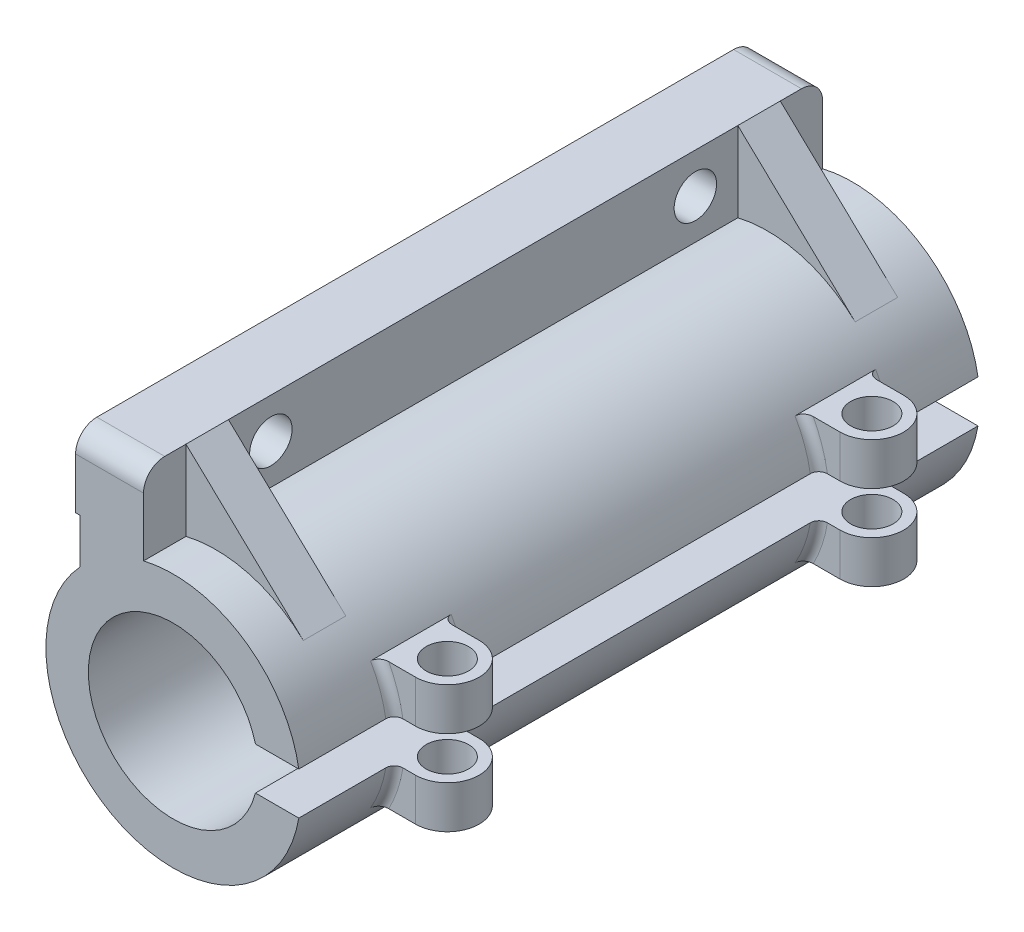
from build123d import *

# Parameters (mm, degrees)
BOSS_EXTRUDE1_DEPTH = 40
BOSS_EXTRUDE2_START = 30
BOSS_EXTRUDE2_DEPTH = 5
BOSS_EXTRUDE3_START = -35
BOSS_EXTRUDE3_DEPTH = 5
SKETCH2_R           = 2.5
CUT_EXTRUDE1_DEPTH  = 15
BOSS_EXTRUDE4_START = 2.5
SKETCH4_R           = 2.5
BOSS_EXTRUDE4_DEPTH = 5
BOSS_EXTRUDE5_START = -7.5
SKETCH4_2_R         = 2.5
BOSS_EXTRUDE5_DEPTH = 5
FILLET1_R           = 1
FILLET2_R           = 2.5


with BuildPart() as part:
    # Sketch1 → Boss-Extrude1 (new, symmetric)
    with BuildSketch(Plane.XY):
        with BuildLine():
            Line((-3.5, 14.585952146), (-3.5, 24))
            Line((-3.5, 24), (-11, 24))
            Line((-11, 24), (-11.5, 24))
            Line((-11.5, 24), (-11.5, 15.5))
            Line((-11.5, 15.5), (-11, 15.5))
            Line((-11, 15.5), (-11, 10.198039027))
            ThreePointArc((-11, 10.198039027), (-6.625817064, -13.457286065), (14.790199458, -2.5))
            Line((14.790199458, -2.5), (9.682458366, -2.5))
            ThreePointArc((9.682458366, -2.5), (-10, 0), (9.682458366, 2.5))
            Line((9.682458366, 2.5), (14.790199458, 2.5))
            ThreePointArc((14.790199458, 2.5), (13.238381204, 7.053032191), (10.325172425, 10.880754312))
            ThreePointArc((10.325172425, 10.880754312), (3.883022973, 14.488689816), (-3.5, 14.585952146))
        make_face()
    extrude(amount=BOSS_EXTRUDE1_DEPTH, both=True)

    # Sketch1<3> → Boss-Extrude2 (add)
    with BuildSketch(Plane.XY.offset(BOSS_EXTRUDE2_START)):
        with BuildLine():
            Line((10.325172425, 10.880754312), (-3.5, 24))
            Line((-3.5, 24), (-3.5, 14.585952146))
            ThreePointArc((-3.5, 14.585952146), (3.883022973, 14.488689816), (10.325172425, 10.880754312))
        make_face()
    extrude(amount=BOSS_EXTRUDE2_DEPTH)

    # Sketch1<4> → Boss-Extrude3 (add)
    with BuildSketch(Plane.XY.offset(BOSS_EXTRUDE3_START)):
        with BuildLine():
            Line((10.325172425, 10.880754312), (-3.5, 24))
            Line((-3.5, 24), (-3.5, 14.585952146))
            ThreePointArc((-3.5, 14.585952146), (3.883022973, 14.488689816), (10.325172425, 10.880754312))
        make_face()
    extrude(amount=BOSS_EXTRUDE3_DEPTH)

    # Sketch2 → Cut-Extrude1 (cut)
    with BuildSketch(Plane(origin=(0, 0, 0), x_dir=(0, 0, -1), z_dir=(1, 0, 0))):
        with Locations((-25, 19.292976073)):
            Circle(SKETCH2_R)
        with Locations((25, 19.292976073)):
            Circle(SKETCH2_R)
    extrude(amount=-CUT_EXTRUDE1_DEPTH, mode=Mode.SUBTRACT)

    # Sketch4 → Boss-Extrude4 (add)
    # profile 1 of 2: a face of its own
    with BuildSketch(Plane(origin=(0, 0, 0), x_dir=(1, 0, 0), z_dir=(0, 1, 0)).offset(BOSS_EXTRUDE4_START)):
        with BuildLine():
            Line((17.290199458, 21.25), (12.290199458, 21.25))
            Line((12.290199458, 21.25), (12.290199458, 28.75))
            Line((12.290199458, 28.75), (17.290199458, 28.75))
            ThreePointArc((17.290199458, 28.75), (21.040199458, 25), (17.290199458, 21.25))
        make_face()
        with Locations((17.290199458, 25)):
            Circle(SKETCH4_R, mode=Mode.SUBTRACT)
    # profile 2 of 2: a face of its own
    with BuildSketch(Plane(origin=(0, 0, 0), x_dir=(1, 0, 0), z_dir=(0, 1, 0)).offset(BOSS_EXTRUDE4_START)):
        with BuildLine():
            Line((12.290199458, -28.75), (17.290199458, -28.75))
            ThreePointArc((17.290199458, -28.75), (21.040199458, -25), (17.290199458, -21.25))
            Line((17.290199458, -21.25), (12.290199458, -21.25))
            Line((12.290199458, -21.25), (12.290199458, -28.75))
        make_face()
        with Locations((17.290199458, -25)):
            Circle(SKETCH4_R, mode=Mode.SUBTRACT)
    extrude(amount=BOSS_EXTRUDE4_DEPTH)

    # Sketch4<2> → Boss-Extrude5 (add)
    # profile 1 of 2: a face of its own
    with BuildSketch(Plane(origin=(0, 0, 0), x_dir=(1, 0, 0), z_dir=(0, 1, 0)).offset(BOSS_EXTRUDE5_START)):
        with BuildLine():
            Line((17.290199458, 21.25), (12.290199458, 21.25))
            Line((12.290199458, 21.25), (12.290199458, 28.75))
            Line((12.290199458, 28.75), (17.290199458, 28.75))
            ThreePointArc((17.290199458, 28.75), (21.040199458, 25), (17.290199458, 21.25))
        make_face()
        with Locations((17.290199458, 25)):
            Circle(SKETCH4_2_R, mode=Mode.SUBTRACT)
    # profile 2 of 2: a face of its own
    with BuildSketch(Plane(origin=(0, 0, 0), x_dir=(1, 0, 0), z_dir=(0, 1, 0)).offset(BOSS_EXTRUDE5_START)):
        with BuildLine():
            Line((12.290199458, -28.75), (17.290199458, -28.75))
            ThreePointArc((17.290199458, -28.75), (21.040199458, -25), (17.290199458, -21.25))
            Line((17.290199458, -21.25), (12.290199458, -21.25))
            Line((12.290199458, -21.25), (12.290199458, -28.75))
        make_face()
        with Locations((17.290199458, -25)):
            Circle(SKETCH4_2_R, mode=Mode.SUBTRACT)
    extrude(amount=BOSS_EXTRUDE5_DEPTH)

    # Fillet1
    fillet1_edges = [part.edges().sort_by_distance(p)[0] for p in [
        (14.113474534, 5.080338234, 21.25),
        (14.113474534, 5.080338234, 28.75),
        (14.113474534, -5.080338234, -28.75),
        (14.113474534, 5.080338234, -28.75),
        (14.113474534, -5.080338234, 21.25),
        (14.113474534, -5.080338234, 28.75),
        (14.113474534, -5.080338234, -21.25),
        (14.113474534, 5.080338234, -21.25),
    ]]
    fillet(fillet1_edges, radius=FILLET1_R)

    # Fillet2
    fillet2_edges = [part.edges().sort_by_distance(p)[0] for p in [
        (-7.5, 24, -40),
        (-7.5, 24, 40),
    ]]
    fillet(fillet2_edges, radius=FILLET2_R)


solid = part.part
